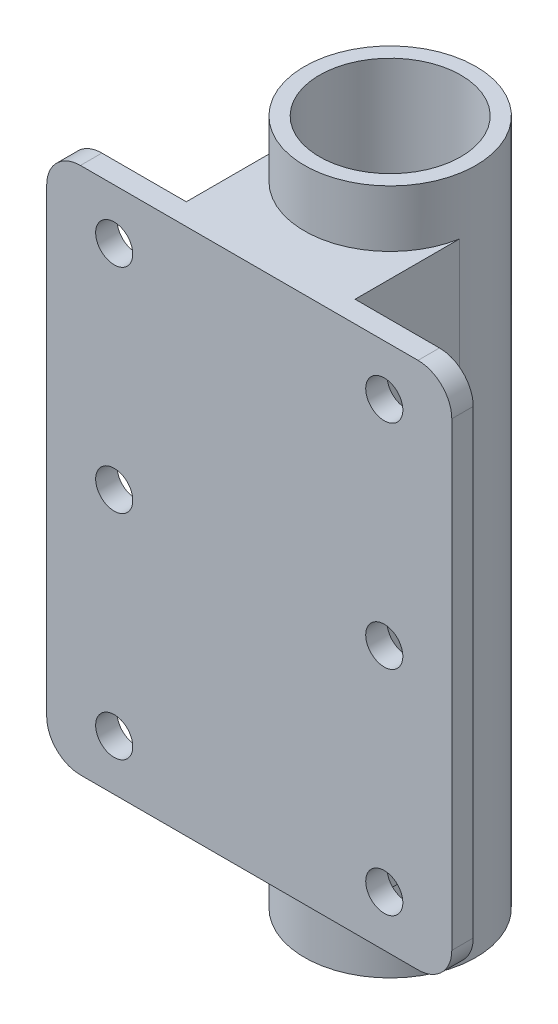
from build123d import *

# Parameters (mm, degrees)
BOSS_EXTRUDE1_START   = -3.175
BOSS_EXTRUDE1_DEPTH   = 3.175
BOSS_EXTRUDE9_START   = -153.2
BOSS_EXTRUDE9_DEPTH   = 153.2
BOSS_EXTRUDE5_START   = 3.175
BOSS_EXTRUDE5_DEPTH   = 3.175
SKETCH18_W            = 120
SKETCH18_H            = 156.375
BOSS_EXTRUDE10_DEPTH  = 6.35
FILLET1_R             = 10
M10_CLEARANCE_HOLE2_D = 11


with BuildPart() as part:
    # Sketch12 → Revolve1 (revolve)
    with BuildSketch(Plane.XY, mode=Mode.PRIVATE) as revolve1_sk:
        Polygon((-25.399999994, 0), (-25.399999994, 203.2), (-20.955, 203.2), (-20.955, 165.1), (-19.177, 165.1), (-19.177, 38.1), (-20.955, 38.1), (-20.955, 0), align=None)
    revolve(revolve1_sk.sketch.rotate(Axis((0, 0, 0), (0, 1, 0)), 270), axis=Axis((0, 0, 0), (0, 1, 0)))

    # Sketch14 → Boss-Extrude1 (add)
    with BuildSketch(Plane(origin=(0, 30, 0), x_dir=(-1, 0, 0), z_dir=(0, -1, 0)).offset(BOSS_EXTRUDE1_START)):
        with BuildLine():
            Line((-21.825, -12.993435831), (-21.825, -35.399999994))
            Line((-21.825, -35.399999994), (21.825, -35.399999994))
            Line((21.825, -35.399999994), (21.825, -12.993435831))
            ThreePointArc((21.825, -12.993435831), (0, -25.399999994), (-21.825, -12.993435831))
        make_face()
    extrude(amount=BOSS_EXTRUDE1_DEPTH)

    # Sketch14<4> → Boss-Extrude9 (add)
    with BuildSketch(Plane(origin=(0, 30, 0), x_dir=(-1, 0, 0), z_dir=(0, -1, 0)).offset(BOSS_EXTRUDE9_START)):
        with BuildLine():
            Line((-25, -4.489988829), (-25, -35.399999994))
            Line((-25, -35.399999994), (-21.825, -35.399999994))
            Line((-21.825, -35.399999994), (-21.825, -12.993435831))
            ThreePointArc((-21.825, -12.993435831), (-23.79542622, -8.884688554), (-25, -4.489988829))
        make_face()
        with BuildLine():
            Line((21.825, -12.993435831), (21.825, -35.399999994))
            Line((21.825, -35.399999994), (25, -35.399999994))
            Line((25, -35.399999994), (25, -4.489988829))
            ThreePointArc((25, -4.489988829), (23.79542622, -8.884688554), (21.825, -12.993435831))
        make_face()
    extrude(amount=BOSS_EXTRUDE9_DEPTH)

    # Sketch17 → Boss-Extrude5 (add)
    with BuildSketch(Plane(origin=(0, 183.2, 0), x_dir=(1, 0, 0), z_dir=(0, 1, 0)).offset(BOSS_EXTRUDE5_START)):
        with BuildLine():
            Line((25, -35.399999994), (25, -4.489988829))
            ThreePointArc((25, -4.489988829), (0, -25.399999994), (-25, -4.489988829))
            Line((-25, -4.489988829), (-25, -35.399999994))
            Line((-25, -35.399999994), (25, -35.399999994))
        make_face()
    extrude(amount=-BOSS_EXTRUDE5_DEPTH)

    # Sketch18 → Boss-Extrude10 (add)
    with BuildSketch(Plane.XY.offset(35.399999994)):
        with Locations((0, 108.1875)):
            Rectangle(SKETCH18_W, SKETCH18_H)
    extrude(amount=BOSS_EXTRUDE10_DEPTH)

    # Fillet1
    fillet1_edges = [part.edges().sort_by_distance(p)[0] for p in [
        (-60, 186.375, 38.574999994),
        (-60, 30, 38.574999994),
        (60, 30, 38.574999994),
        (60, 186.375, 38.574999994),
    ]]
    fillet(fillet1_edges, radius=FILLET1_R)

    # M10 Clearance Hole2 (through all)
    with Locations(Plane(origin=(-40, 45, 35.399999994), x_dir=(-1, 0, 0), z_dir=(0, 0, -1))):
        with Locations((0, 0), (0, 63.1875), (0, 126.375), (-80, 126.375), (-80, 63.1875), (-80, 0)):
            Hole(M10_CLEARANCE_HOLE2_D / 2)


solid = part.part
